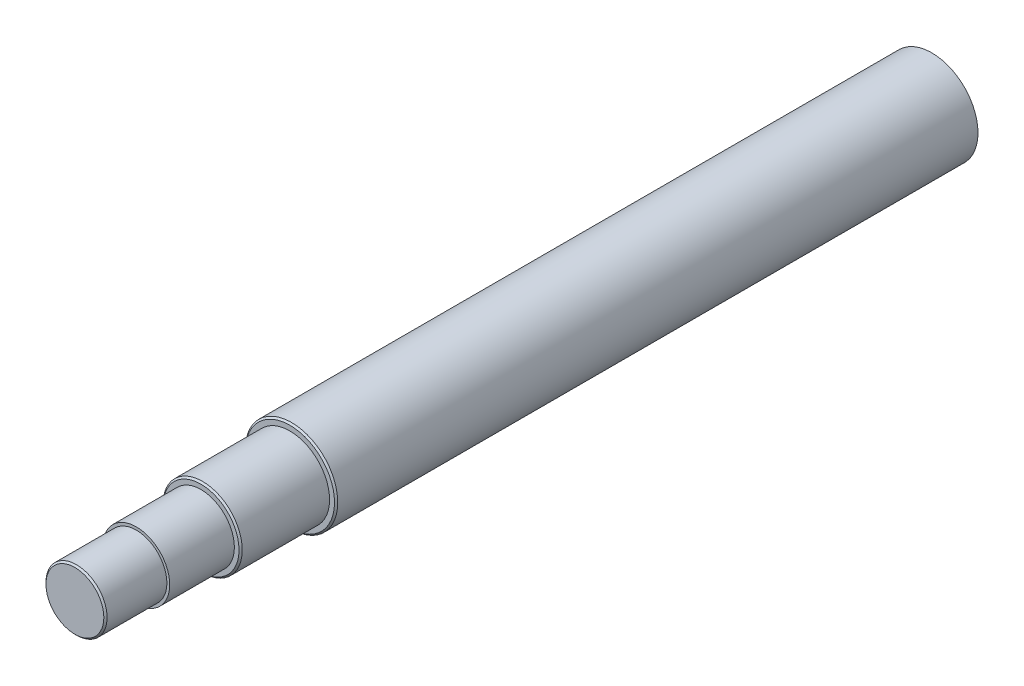
from build123d import *

# Parameters (mm, degrees)
SKETCH1_R           = 28.575
BOSS_EXTRUDE1_DEPTH = 530
SKETCH2_OUTSIDE_W   = 166.376
SKETCH2_OUTSIDE_H   = 166.376
SKETCH2_OUTSIDE_R   = 18.9
CUT_EXTRUDE4_DEPTH  = 38
SKETCH3_OUTSIDE_W   = 166.376
SKETCH3_OUTSIDE_H   = 166.376
SKETCH3_OUTSIDE_R   = 20.64
CUT_EXTRUDE5_DEPTH  = 40
SKETCH4_OUTSIDE_W   = 166.376
SKETCH4_OUTSIDE_H   = 166.376
SKETCH4_OUTSIDE_R   = 24.5
CUT_EXTRUDE6_DEPTH  = 55
SKETCH5_R           = 5
BOSS_EXTRUDE2_DEPTH = 5
CHAMFER1_SIZE       = 1


with BuildPart() as part:
    # Sketch1 → Boss-Extrude1 (new body)
    with BuildSketch(Plane.XY):
        Circle(SKETCH1_R)
    extrude(amount=BOSS_EXTRUDE1_DEPTH)

    # Sketch2 outside → Cut-Extrude4 (cut)
    with BuildSketch(Plane.XY.offset(530)):
        Rectangle(SKETCH2_OUTSIDE_W, SKETCH2_OUTSIDE_H)
        Circle(SKETCH2_OUTSIDE_R, mode=Mode.SUBTRACT)
    extrude(amount=-CUT_EXTRUDE4_DEPTH, mode=Mode.SUBTRACT)

    # Sketch3 outside → Cut-Extrude5 (cut)
    with BuildSketch(Plane.XY.offset(492)):
        Rectangle(SKETCH3_OUTSIDE_W, SKETCH3_OUTSIDE_H)
        Circle(SKETCH3_OUTSIDE_R, mode=Mode.SUBTRACT)
    extrude(amount=-CUT_EXTRUDE5_DEPTH, mode=Mode.SUBTRACT)

    # Sketch4 outside → Cut-Extrude6 (cut)
    with BuildSketch(Plane.XY.offset(452)):
        Rectangle(SKETCH4_OUTSIDE_W, SKETCH4_OUTSIDE_H)
        Circle(SKETCH4_OUTSIDE_R, mode=Mode.SUBTRACT)
    extrude(amount=-CUT_EXTRUDE6_DEPTH, mode=Mode.SUBTRACT)

    # Sketch5 → Boss-Extrude2 (add)
    with BuildSketch(Plane(origin=(0, 0, 0), x_dir=(-1, 0, 0), z_dir=(0, 0, -1))):
        Circle(SKETCH5_R)
    extrude(amount=BOSS_EXTRUDE2_DEPTH)

    # Chamfer1
    chamfer1_edges = [part.edges().sort_by_distance(p)[0] for p in [
        (-18.9, 0, 530),
        (-28.575, 0, 397),
        (-24.5, 0, 452),
    ]]
    chamfer(chamfer1_edges, length=CHAMFER1_SIZE)


solid = part.part
